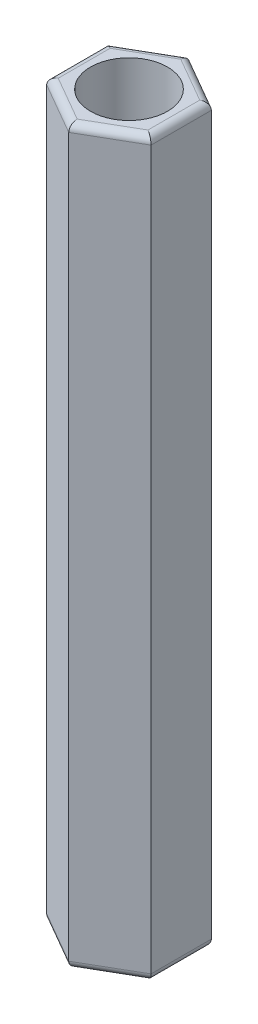
from build123d import *

# Parameters (mm, degrees)
SKETCH1_R           = 1.05
BOSS_EXTRUDE1_DEPTH = 20
FILLET1_R           = 0.2


with BuildPart() as part:
    # Sketch1 → Boss-Extrude1 (new body)
    with BuildSketch(Plane(origin=(0, 0, 0), x_dir=(1, 0, 0), z_dir=(0, 1, 0))):
        Polygon((1.425, 0.822724134), (0, 1.645448267), (-1.425, 0.822724134), (-1.425, -0.822724134), (0, -1.645448267), (1.425, -0.822724134), align=None)
        with Locations(Location((0, 0, 0), (0, 0, 270))):
            Circle(SKETCH1_R, mode=Mode.SUBTRACT)
    extrude(amount=BOSS_EXTRUDE1_DEPTH)

    # Fillet1
    fillet1_edges = [part.edges().sort_by_distance(p)[0] for p in [
        (-0.7125, 20, -1.2340862),
        (-1.425, 20, 0),
        (-0.7125, 20, 1.2340862),
        (0.7125, 20, 1.2340862),
        (1.425, 20, 0),
        (0.7125, 0, 1.2340862),
        (-0.7125, 0, 1.2340862),
        (-1.425, 0, 0),
        (-0.7125, 0, -1.2340862),
        (0.7125, 0, -1.2340862),
        (1.425, 0, 0),
        (0.7125, 20, -1.2340862),
    ]]
    fillet(fillet1_edges, radius=FILLET1_R)


solid = part.part
